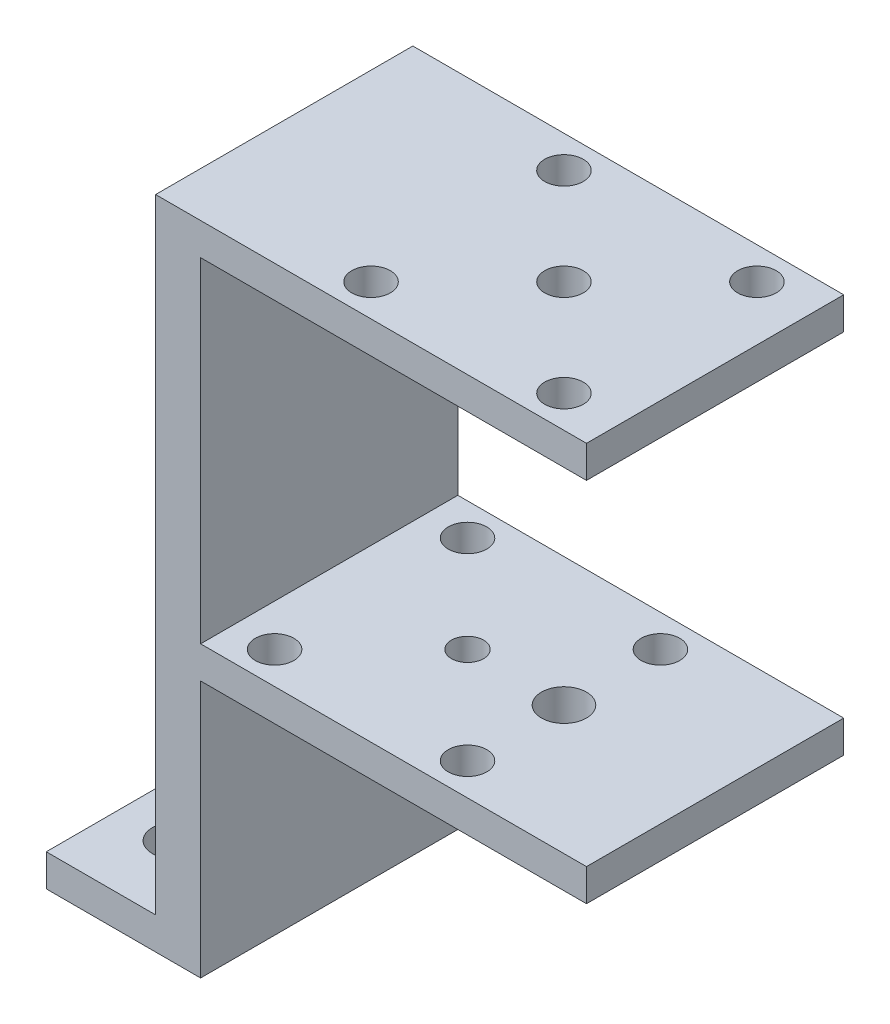
from build123d import *

# Parameters (mm, degrees)
SALIENTE_EXTRUIR1_DEPTH = 40
CORTAR_EXTRUIR1_REACH   = 122.868
CROQUIS2_R              = 3.5
CORTAR_EXTRUIR4_START   = -62
CROQUIS3_R              = 3
CORTAR_EXTRUIR4_DEPTH   = 5
CORTAR_EXTRUIR3_REACH   = 93.918
CROQUIS4_R              = 2.5
CROQUIS4_R_2            = 3.5
CORTAR_EXTRUIR5_REACH   = 126.916
CROQUIS5_R              = 3


with BuildPart() as part:
    # Croquis1 → Saliente-Extruir1 (new body)
    with BuildSketch(Plane.XY):
        Polygon((0, 0), (0, 40), (60, 40), (60, 45), (0, 45), (0, 97), (60, 97), (60, 102), (-7, 102), (-7, 5), (-24, 5), (-24, 0), align=None)
    extrude(amount=SALIENTE_EXTRUIR1_DEPTH)

    # Croquis2 → Cortar-Extruir1 (cut, up to next)
    with BuildSketch(Plane(origin=(0, 5, 0), x_dir=(1, 0, 0), z_dir=(0, 1, 0)), mode=Mode.PRIVATE) as cortar_extruir1_sk1:
        with Locations(Location((-15.5, -11.5, 0), (0, 0, 180))):
            Circle(CROQUIS2_R)
    cortar_extruir1_tool1 = extrude(cortar_extruir1_sk1.sketch, amount=-CORTAR_EXTRUIR1_REACH, mode=Mode.PRIVATE) & part.part
    # Croquis2 → Cortar-Extruir1 (cut, up to next)
    with BuildSketch(Plane(origin=(0, 5, 0), x_dir=(1, 0, 0), z_dir=(0, 1, 0)), mode=Mode.PRIVATE) as cortar_extruir1_sk2:
        with Locations(Location((-15.5, -28.5, 0), (0, 0, 180))):
            Circle(CROQUIS2_R)
    cortar_extruir1_tool2 = extrude(cortar_extruir1_sk2.sketch, amount=-CORTAR_EXTRUIR1_REACH, mode=Mode.PRIVATE) & part.part
    add(cortar_extruir1_tool1.solids().sort_by_distance((-15.5, 5, 11.5))[0], mode=Mode.SUBTRACT)
    add(cortar_extruir1_tool2.solids().sort_by_distance((-15.5, 5, 28.5))[0], mode=Mode.SUBTRACT)

    # Croquis3 → Cortar-Extruir4 (cut)
    with BuildSketch(Plane(origin=(0, 102, 0), x_dir=(1, 0, 0), z_dir=(0, 1, 0)).offset(CORTAR_EXTRUIR4_START)):
        with Locations(Location((6.5, -5, 0), (0, 0, 270))):
            Circle(CROQUIS3_R)
        with Locations(Location((36.5, -5, 0), (0, 0, 270))):
            Circle(CROQUIS3_R)
        with Locations(Location((6.5, -35, 0), (0, 0, 270))):
            Circle(CROQUIS3_R)
        with Locations(Location((36.5, -35, 0), (0, 0, 270))):
            Circle(CROQUIS3_R)
    extrude(amount=CORTAR_EXTRUIR4_DEPTH, mode=Mode.SUBTRACT)

    # Croquis4 → Cortar-Extruir3 (cut, up to next)
    with BuildSketch(Plane(origin=(0, 45, 0), x_dir=(1, 0, 0), z_dir=(0, 1, 0)), mode=Mode.PRIVATE) as cortar_extruir3_sk1:
        with Locations(Location((21.5, -20, 0), (0, 0, 180))):
            Circle(CROQUIS4_R)
    cortar_extruir3_tool1 = extrude(cortar_extruir3_sk1.sketch, amount=-CORTAR_EXTRUIR3_REACH, mode=Mode.PRIVATE) & part.part
    # Croquis4 → Cortar-Extruir3 (cut, up to next)
    with BuildSketch(Plane(origin=(0, 45, 0), x_dir=(1, 0, 0), z_dir=(0, 1, 0)), mode=Mode.PRIVATE) as cortar_extruir3_sk2:
        with Locations(Location((36.5, -20, 0), (0, 0, 180))):
            Circle(CROQUIS4_R_2)
    cortar_extruir3_tool2 = extrude(cortar_extruir3_sk2.sketch, amount=-CORTAR_EXTRUIR3_REACH, mode=Mode.PRIVATE) & part.part
    add(cortar_extruir3_tool1.solids().sort_by_distance((21.5, 45, 20))[0], mode=Mode.SUBTRACT)
    add(cortar_extruir3_tool2.solids().sort_by_distance((36.5, 45, 20))[0], mode=Mode.SUBTRACT)

    # Croquis5 → Cortar-Extruir5 (cut, up to next)
    with BuildSketch(Plane(origin=(0, 102, 0), x_dir=(1, 0, 0), z_dir=(0, 1, 0)), mode=Mode.PRIVATE) as cortar_extruir5_sk1:
        with Locations(Location((21.5, -5, 0), (0, 0, 270))):
            Circle(CROQUIS5_R)
    cortar_extruir5_tool1 = extrude(cortar_extruir5_sk1.sketch, amount=-CORTAR_EXTRUIR5_REACH, mode=Mode.PRIVATE) & part.part
    # Croquis5 → Cortar-Extruir5 (cut, up to next)
    with BuildSketch(Plane(origin=(0, 102, 0), x_dir=(1, 0, 0), z_dir=(0, 1, 0)), mode=Mode.PRIVATE) as cortar_extruir5_sk2:
        with Locations(Location((51.5, -5, 0), (0, 0, 270))):
            Circle(CROQUIS5_R)
    cortar_extruir5_tool2 = extrude(cortar_extruir5_sk2.sketch, amount=-CORTAR_EXTRUIR5_REACH, mode=Mode.PRIVATE) & part.part
    # Croquis5 → Cortar-Extruir5 (cut, up to next)
    with BuildSketch(Plane(origin=(0, 102, 0), x_dir=(1, 0, 0), z_dir=(0, 1, 0)), mode=Mode.PRIVATE) as cortar_extruir5_sk3:
        with Locations(Location((21.5, -35, 0), (0, 0, 270))):
            Circle(CROQUIS5_R)
    cortar_extruir5_tool3 = extrude(cortar_extruir5_sk3.sketch, amount=-CORTAR_EXTRUIR5_REACH, mode=Mode.PRIVATE) & part.part
    # Croquis5 → Cortar-Extruir5 (cut, up to next)
    with BuildSketch(Plane(origin=(0, 102, 0), x_dir=(1, 0, 0), z_dir=(0, 1, 0)), mode=Mode.PRIVATE) as cortar_extruir5_sk4:
        with Locations(Location((51.5, -35, 0), (0, 0, 270))):
            Circle(CROQUIS5_R)
    cortar_extruir5_tool4 = extrude(cortar_extruir5_sk4.sketch, amount=-CORTAR_EXTRUIR5_REACH, mode=Mode.PRIVATE) & part.part
    # Croquis5 → Cortar-Extruir5 (cut, up to next)
    with BuildSketch(Plane(origin=(0, 102, 0), x_dir=(1, 0, 0), z_dir=(0, 1, 0)), mode=Mode.PRIVATE) as cortar_extruir5_sk5:
        with Locations(Location((36.5, -20, 0), (0, 0, 270))):
            Circle(CROQUIS5_R)
    cortar_extruir5_tool5 = extrude(cortar_extruir5_sk5.sketch, amount=-CORTAR_EXTRUIR5_REACH, mode=Mode.PRIVATE) & part.part
    add(cortar_extruir5_tool1.solids().sort_by_distance((21.5, 102, 5))[0], mode=Mode.SUBTRACT)
    add(cortar_extruir5_tool2.solids().sort_by_distance((51.5, 102, 5))[0], mode=Mode.SUBTRACT)
    add(cortar_extruir5_tool3.solids().sort_by_distance((21.5, 102, 35))[0], mode=Mode.SUBTRACT)
    add(cortar_extruir5_tool4.solids().sort_by_distance((51.5, 102, 35))[0], mode=Mode.SUBTRACT)
    add(cortar_extruir5_tool5.solids().sort_by_distance((36.5, 102, 20))[0], mode=Mode.SUBTRACT)


solid = part.part
